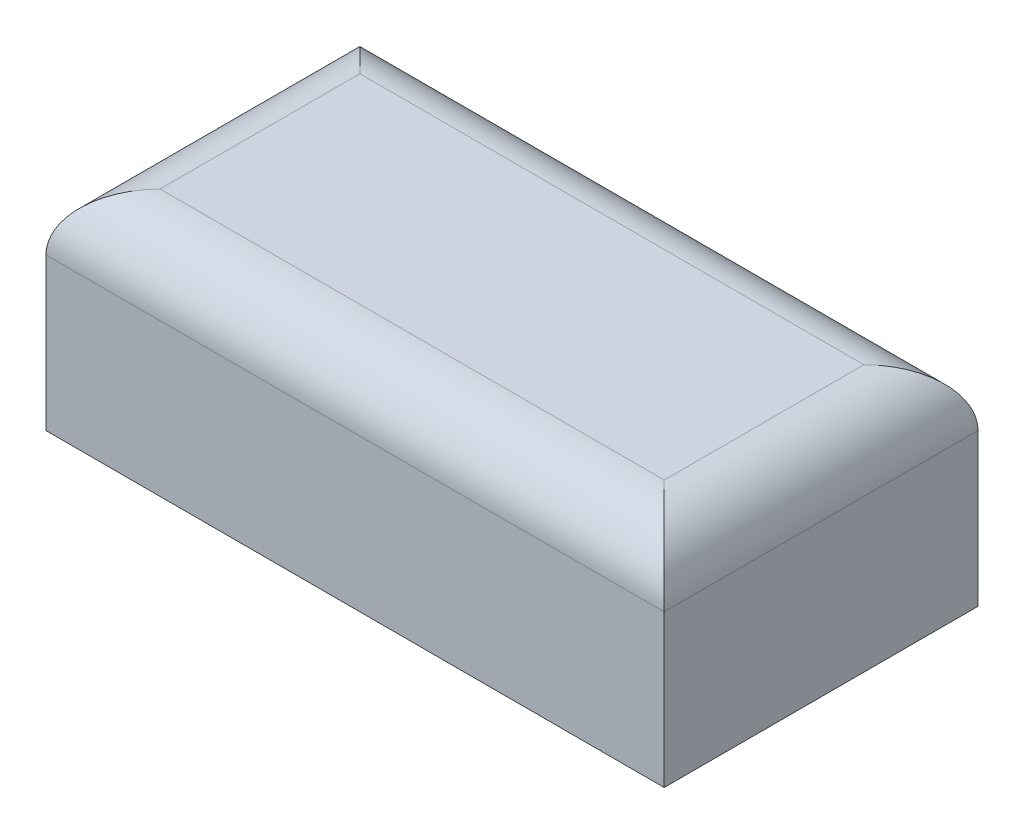
from build123d import *

# Parameters (mm, degrees)
SKETCH1_R           = 6.7
SKETCH1_R_2         = 6.055
BOSS_EXTRUDE1_DEPTH = 1.3
SKETCH1_2_R         = 6.055
BOSS_EXTRUDE2_DEPTH = 5.6
SKETCH2_W           = 32.5
SKETCH2_H           = 16.5
BOSS_EXTRUDE3_DEPTH = 11
FILLET1_R           = 3


with BuildPart() as part:
    # Sketch1 → Boss-Extrude1 (new body)
    with BuildSketch(Plane(origin=(0, 0, 0), x_dir=(1, 0, 0), z_dir=(0, 1, 0))):
        Circle(SKETCH1_R)
        Circle(SKETCH1_R_2, mode=Mode.SUBTRACT)
    extrude(amount=BOSS_EXTRUDE1_DEPTH)

    # Sketch1<2> → Boss-Extrude2 (add)
    with BuildSketch(Plane(origin=(0, 0, 0), x_dir=(1, 0, 0), z_dir=(0, 1, 0))):
        Circle(SKETCH1_2_R)
    extrude(amount=BOSS_EXTRUDE2_DEPTH)


with BuildPart() as body_2:
    # Sketch2 → Boss-Extrude3 (new body)
    with BuildSketch(Plane(origin=(0, 0, 0), x_dir=(1, 0, 0), z_dir=(0, 1, 0))):
        Rectangle(SKETCH2_W, SKETCH2_H)
    extrude(amount=BOSS_EXTRUDE3_DEPTH)

    # Combine1: cut part
    add(part.part, mode=Mode.SUBTRACT)

    # Fillet1
    fillet1_edges = [body_2.edges().sort_by_distance(p)[0] for p in [
        (0, 11, 8.25),
        (-16.25, 11, 0),
        (0, 11, -8.25),
        (16.25, 11, 0),
    ]]
    fillet(fillet1_edges, radius=FILLET1_R)


solid = body_2.part
